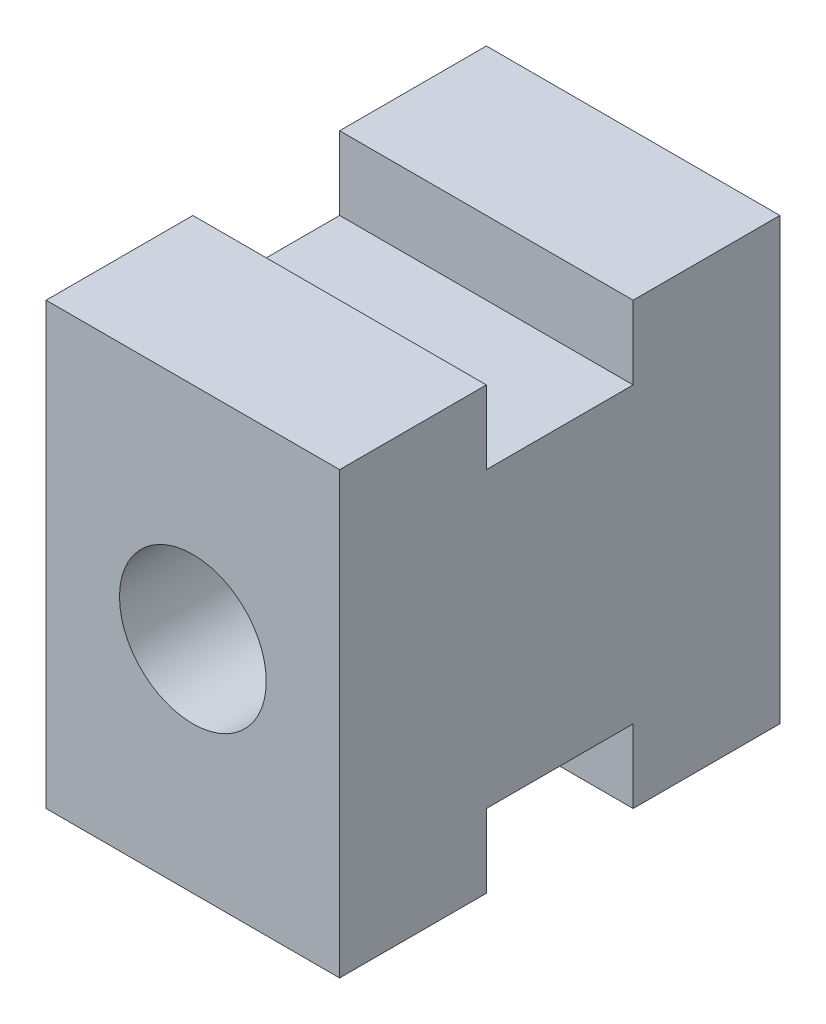
from build123d import *

# Parameters (mm, degrees)
SKETCH_1_W          = 4
SKETCH_1_H          = 6
SKETCH_1_R          = 1
EXTRUDE_1_DEPTH     = 6
SKETCH_2_W          = 2
SKETCH_2_H          = 1
CUT_EXTRUDE_1_DEPTH = 8.810249676


with BuildPart() as part:
    # 草图1 → 凸台-拉伸1 (new body)
    with BuildSketch(Plane.XY):
        Rectangle(SKETCH_1_W, SKETCH_1_H)
        Circle(SKETCH_1_R, mode=Mode.SUBTRACT)
    extrude(amount=EXTRUDE_1_DEPTH)

    # 草图2 → 切除-拉伸1 (cut, through all)
    with BuildSketch(Plane(origin=(2, 0, 0), x_dir=(0, 0, -1), z_dir=(1, 0, 0))):
        with Locations((-3, 2.5)):
            Rectangle(SKETCH_2_W, SKETCH_2_H)
        with Locations((-3, -2.5)):
            Rectangle(SKETCH_2_W, SKETCH_2_H)
    extrude(amount=-CUT_EXTRUDE_1_DEPTH, mode=Mode.SUBTRACT)


solid = part.part
